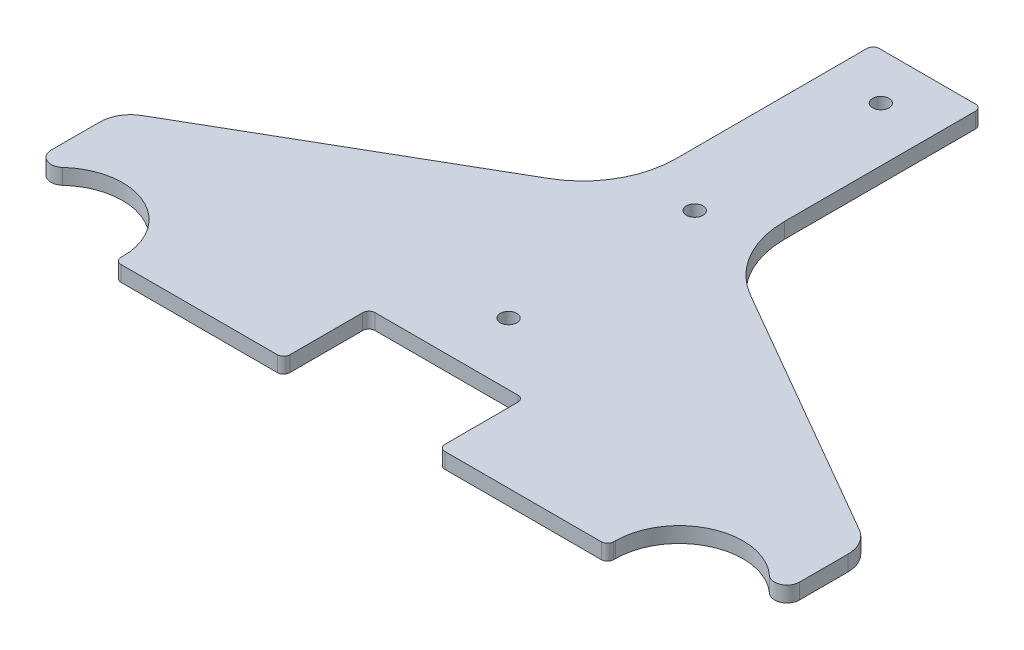
from build123d import *

# Parameters (mm, degrees)
BOSS_EXTRUDE1_DEPTH     = 6.35
SKETCH2_W               = 63.5
SKETCH2_H               = 34.925
CUT_EXTRUDE1_DEPTH      = 299.126542166
F_1_4_CLEARANCE_HOLE1_D = 6.7564
CUT_EXTRUDE2_DEPTH      = 299.126542166
FILLET1_R               = 25.4
FILLET2_R               = 5.08
FILLET3_R               = 2.54
CUT_EXTRUDE4_DEPTH      = 276.239678724
FILLET5_R               = 12.7
FILLET6_R               = 38.1


with BuildPart() as part:
    # Sketch1 → Boss-Extrude1 (new body)
    with BuildSketch(Plane(origin=(0, 0, 0), x_dir=(1, 0, 0), z_dir=(0, 1, 0))):
        with BuildLine():
            Line((22.225, 228.6), (-22.225, 228.6))
            Line((-22.225, 228.6), (-22.225, 190.5))
            ThreePointArc((-22.225, 190.5), (-25.761770597, 174.46899338), (-35.715455289, 161.414259351))
            Line((-35.715455289, 161.414259351), (-168.508098746, 49.057949228))
            ThreePointArc((-168.508098746, 49.057949228), (-185.296646926, 27.038964499), (-191.262, 0))
            Line((-191.262, 0), (-191.262, -3.175))
            Line((-191.262, -3.175), (-153.162, -3.175))
            Line((-153.162, -3.175), (-153.162, 0))
            ThreePointArc((-153.162, 0), (-127, 26.162), (-100.838, 0))
            Line((-100.838, 0), (-100.838, -3.175))
            Line((-100.838, -3.175), (100.838, -3.175))
            Line((100.838, -3.175), (100.838, 0))
            ThreePointArc((100.838, 0), (127, 26.162), (153.162, 0))
            Line((153.162, 0), (153.162, -3.175))
            Line((153.162, -3.175), (191.262, -3.175))
            Line((191.262, -3.175), (191.262, 0))
            ThreePointArc((191.262, 0), (185.296646926, 27.038964499), (168.508098746, 49.057949228))
            Line((168.508098746, 49.057949228), (35.715455289, 161.414259351))
            ThreePointArc((35.715455289, 161.414259351), (25.761770597, 174.46899338), (22.225, 190.5))
            Line((22.225, 190.5), (22.225, 228.6))
        make_face()
    extrude(amount=BOSS_EXTRUDE1_DEPTH)

    # Sketch2 → Cut-Extrude1 (cut, through all)
    with BuildSketch(Plane(origin=(0, 6.35, 0), x_dir=(1, 0, 0), z_dir=(0, 1, 0))):
        with Locations((0, 14.2875)):
            Rectangle(SKETCH2_W, SKETCH2_H)
    extrude(amount=-CUT_EXTRUDE1_DEPTH, mode=Mode.SUBTRACT)

    # 1/4 Clearance Hole1 (through all)
    with Locations(Plane(origin=(0, 6.35, 0), x_dir=(1, 0, 0), z_dir=(0, 1, 0))):
        with Locations((0, 209.55), (0, 133.35), (0, 57.15)):
            Hole(F_1_4_CLEARANCE_HOLE1_D / 2)

    # Sketch5 → Cut-Extrude2 (cut, through all)
    with BuildSketch(Plane(origin=(0, 6.35, 0), x_dir=(1, 0, 0), z_dir=(0, 1, 0))):
        with BuildLine():
            Line((-153.162, -3.175), (-153.162, 62.042335901))
            Line((-153.162, 62.042335901), (-168.508098746, 49.057949228))
            ThreePointArc((-168.508098746, 49.057949228), (-185.296646926, 27.038964499), (-191.262, 0))
            Line((-191.262, 0), (-191.262, -3.175))
            Line((-191.262, -3.175), (-153.162, -3.175))
        make_face()
        with BuildLine():
            Line((191.262, 0), (191.262, -3.175))
            Line((191.262, -3.175), (153.162, -3.175))
            Line((153.162, -3.175), (153.162, 62.042335901))
            Line((153.162, 62.042335901), (168.508098746, 49.057949228))
            ThreePointArc((168.508098746, 49.057949228), (185.296646926, 27.038964499), (191.262, 0))
        make_face()
    extrude(amount=-CUT_EXTRUDE2_DEPTH, mode=Mode.SUBTRACT)

    # Fillet1
    fillet1_edges = [part.edges().sort_by_distance(p)[0] for p in [
        (153.162, 3.175, -62.042335901),
        (-153.162, 3.175, -62.042335901),
    ]]
    fillet(fillet1_edges, radius=FILLET1_R)

    # Fillet2
    fillet2_edges = [part.edges().sort_by_distance(p)[0] for p in [
        (153.162, 3.175, 0),
        (-153.162, 3.175, 0),
    ]]
    fillet(fillet2_edges, radius=FILLET2_R)

    # Fillet3
    fillet3_edges = [part.edges().sort_by_distance(p)[0] for p in [
        (-22.225, 3.175, -228.6),
        (22.225, 3.175, -228.6),
        (100.838, 3.175, 3.175),
        (-100.838, 3.175, 3.175),
        (31.75, 3.175, 3.175),
        (-31.75, 3.175, 3.175),
        (-31.75, 3.175, -31.75),
        (31.75, 3.175, -31.75),
    ]]
    fillet(fillet3_edges, radius=FILLET3_R)

    # Sketch7 → Cut-Extrude4 (cut, through all)
    with BuildSketch(Plane(origin=(0, 6.35, 0), x_dir=(1, 0, 0), z_dir=(0, 1, 0))):
        Polygon((-22.225, 125.857901259), (-153.162, 50.261389063), (-153.162, 60.856337773), (-22.225, 190.5), align=None)
        Polygon((153.162, 60.856337773), (153.162, 50.261389063), (22.225, 125.857901259), (22.225, 190.5), align=None)
    extrude(amount=-CUT_EXTRUDE4_DEPTH, mode=Mode.SUBTRACT)

    # Fillet5
    fillet5_edges = [part.edges().sort_by_distance(p)[0] for p in [
        (153.162, 3.175, -50.261389063),
        (-153.162, 3.175, -50.261389063),
    ]]
    fillet(fillet5_edges, radius=FILLET5_R)

    # Fillet6
    fillet6_edges = [part.edges().sort_by_distance(p)[0] for p in [
        (-22.225, 3.175, -125.857901259),
        (22.225, 3.175, -125.857901259),
    ]]
    fillet(fillet6_edges, radius=FILLET6_R)


solid = part.part
